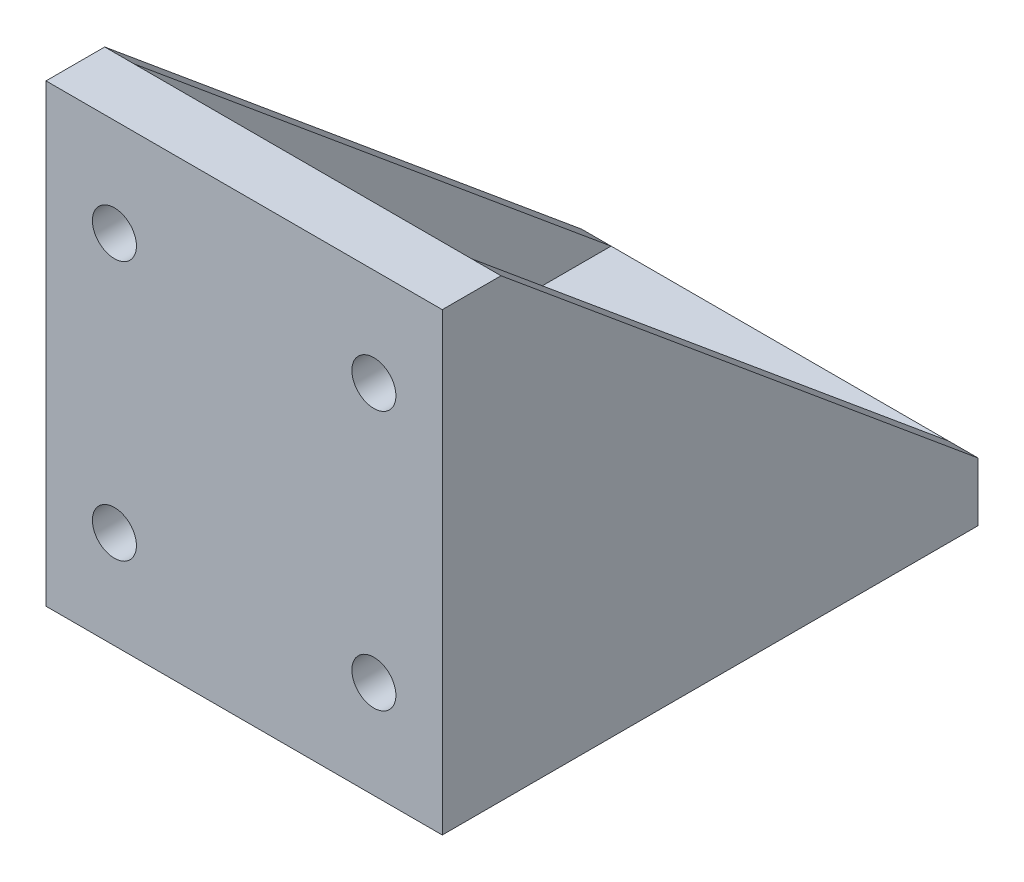
from build123d import *

# Parameters (mm, degrees)
BOSS_EXTRUDE1_DEPTH      = 27
BOSS_EXTRUDE1_DEPTH_BACK = 27
CUT_EXTRUDE1_START       = -8
SKETCH4_W                = 46
SKETCH4_H                = 54
CUT_EXTRUDE1_DEPTH       = 76.779472426
SKETCH5_R                = 3
CUT_EXTRUDE2_DEPTH       = 84.779472426
SKETCH6_R                = 2
CUT_EXTRUDE4_DEPTH       = 10


with BuildPart() as part:
    # Sketch1 → Boss-Extrude1 (new, two sides: drawn at the far end of the back side and taken through both)
    with BuildSketch(Plane(origin=(0, 0, 0), x_dir=(0, 0, -1), z_dir=(1, 0, 0)).offset(-BOSS_EXTRUDE1_DEPTH_BACK)):
        Polygon((0, 31), (0, -31), (73, -31), (73, -23), (8, 31), align=None)
    extrude(amount=BOSS_EXTRUDE1_DEPTH + BOSS_EXTRUDE1_DEPTH_BACK)

    # Sketch4 → Cut-Extrude1 (cut, through all)
    with BuildSketch(Plane.XY.offset(CUT_EXTRUDE1_START)):
        with Locations((0, 4)):
            Rectangle(SKETCH4_W, SKETCH4_H)
    extrude(amount=-CUT_EXTRUDE1_DEPTH, mode=Mode.SUBTRACT)

    # Sketch5 → Cut-Extrude2 (cut, through all)
    with BuildSketch(Plane(origin=(0, 0, 0), x_dir=(-1, 0, 0), z_dir=(0, 0, -1))):
        with Locations((17.67766953, 17.67766953)):
            Circle(SKETCH5_R)
        with Locations((17.67766953, -17.67766953)):
            Circle(SKETCH5_R)
        with Locations((-17.67766953, -17.67766953)):
            Circle(SKETCH5_R)
        with Locations((-17.67766953, 17.67766953)):
            Circle(SKETCH5_R)
    extrude(amount=CUT_EXTRUDE2_DEPTH, mode=Mode.SUBTRACT)

    # Sketch6 → Cut-Extrude4 (cut)
    with BuildSketch(Plane(origin=(0, -31, -35), x_dir=(1, 0, 0), z_dir=(0, 1, 0))):
        with Locations((0, -21)):
            Circle(SKETCH6_R)
        with Locations((0, 24)):
            Circle(SKETCH6_R)
        with Locations((18, 1.5)):
            Circle(SKETCH6_R)
        with Locations((-18, 1.5)):
            Circle(SKETCH6_R)
    extrude(amount=CUT_EXTRUDE4_DEPTH, mode=Mode.SUBTRACT)


solid = part.part
